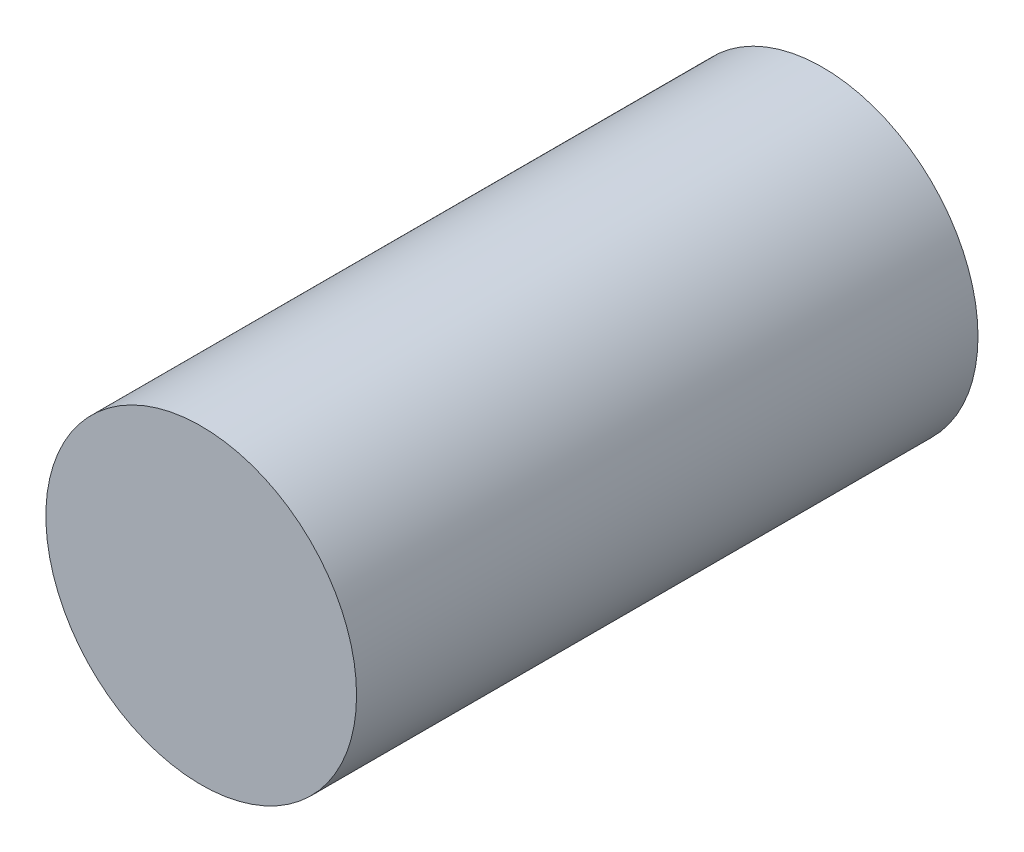
from build123d import *

# Parameters (mm, degrees)
DOWEL_PROFILE_R = 1.27
DOWEL_DEPTH     = 2.54


with BuildPart() as part:
    # Dowel Profile → Dowel (new, symmetric)
    with BuildSketch(Plane.XY):
        Circle(DOWEL_PROFILE_R)
    extrude(amount=DOWEL_DEPTH, both=True)


solid = part.part
